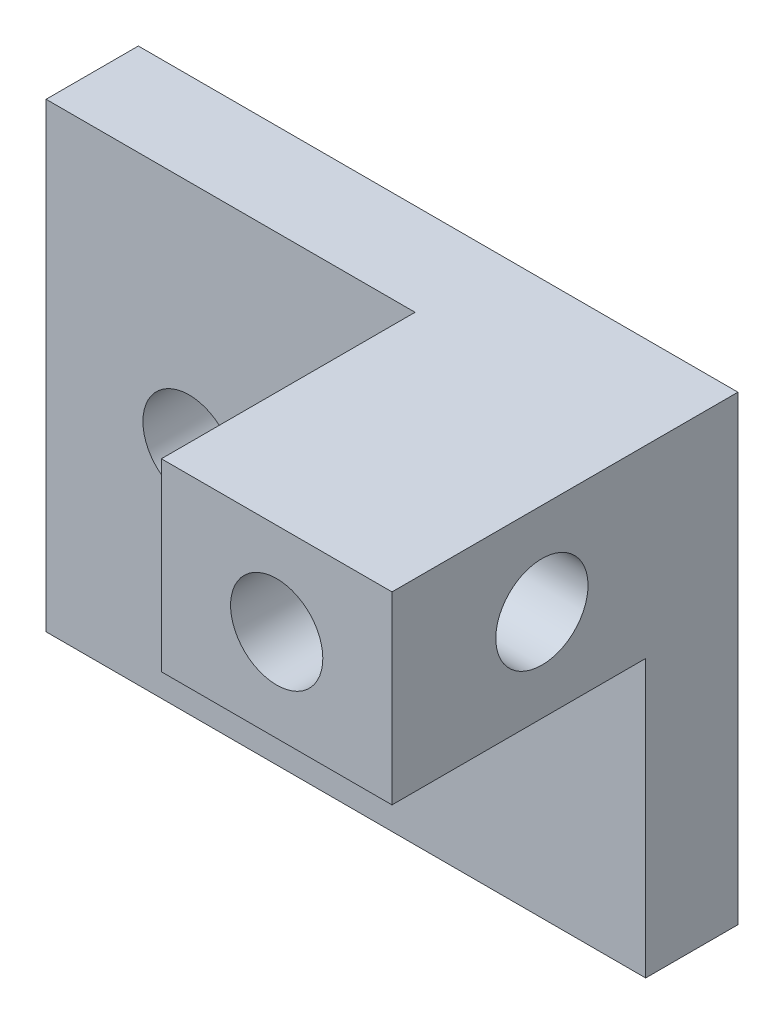
from build123d import *

# Parameters (mm, degrees)
SKETCH_1_W          = 130
SKETCH_1_H          = 100
EXTRUDE_1_DEPTH     = 20
SKETCH_2_W          = 60
SKETCH_2_H          = 76
SKETCH_2_W_2        = 38
CUT_EXTRUDE_1_DEPTH = 10
SKETCH_3_W          = 50
SKETCH_3_H          = 40
EXTRUDE_2_DEPTH     = 65
SKETCH_4_R          = 10
CUT_EXTRUDE_2_DEPTH = 105.642247682
SKETCH_5_R          = 10
CUT_EXTRUDE_3_DEPTH = 121.519707932
SKETCH_6_R          = 10
CUT_EXTRUDE_4_DEPTH = 112.130553854
EXTRUDE_START       = 10
SKETCH_7_W          = 38
SKETCH_7_H          = 76
SKETCH_7_R          = 10
EXTRUDE_3_DEPTH     = 10


with BuildPart() as part:
    # Эскиз1 → Бобышка-Вытянуть1 (new body)
    with BuildSketch(Plane.XY):
        Rectangle(SKETCH_1_W, SKETCH_1_H)
    extrude(amount=EXTRUDE_1_DEPTH)

    # Эскиз2 → Вырез-Вытянуть1 (cut)
    with BuildSketch(Plane.XY.offset(20)):
        with Locations((23, 0)):
            Rectangle(SKETCH_2_W, SKETCH_2_H)
        with Locations((-34, 0)):
            Rectangle(SKETCH_2_W_2, SKETCH_2_H)
    extrude(amount=-CUT_EXTRUDE_1_DEPTH, mode=Mode.SUBTRACT)

    # Эскиз3 → Бобышка-Вытянуть2 (add)
    with BuildSketch(Plane.XY.offset(10)):
        with Locations((40, 30)):
            Rectangle(SKETCH_3_W, SKETCH_3_H)
    extrude(amount=EXTRUDE_2_DEPTH)

    # Эскиз4 → Вырез-Вытянуть2 (cut, through all)
    with BuildSketch(Plane.XY.offset(10)):
        with Locations((-34, 0)):
            Circle(SKETCH_4_R)
    extrude(amount=-CUT_EXTRUDE_2_DEPTH, mode=Mode.SUBTRACT)

    # Эскиз5 → Вырез-Вытянуть3 (cut, through all)
    with BuildSketch(Plane.ZY.offset(-15)):
        with Locations(Location((42.5, 30, 0), (0, 0, 270))):
            Circle(SKETCH_5_R)
    extrude(amount=-CUT_EXTRUDE_3_DEPTH, mode=Mode.SUBTRACT)

    # Эскиз6 → Вырез-Вытянуть4 (cut, through all)
    with BuildSketch(Plane.XY.offset(75)):
        with Locations((40, 30)):
            Circle(SKETCH_6_R)
    extrude(amount=-CUT_EXTRUDE_4_DEPTH, mode=Mode.SUBTRACT)

    # Эскиз7 → Бобышка-Вытянуть3 (add)
    # profile 1 of 2: a face of its own
    with BuildSketch(Plane.XY.offset(10).offset(EXTRUDE_START)):
        Polygon((15, 10), (15, 38), (-7, 38), (-7, -38), (53, -38), (53, 10), align=None)
    # profile 2 of 2: a face of its own
    with BuildSketch(Plane.XY.offset(10).offset(EXTRUDE_START)):
        with Locations((-34, 0)):
            Rectangle(SKETCH_7_W, SKETCH_7_H)
        with Locations((-34, 0)):
            Circle(SKETCH_7_R, mode=Mode.SUBTRACT)
    extrude(amount=-EXTRUDE_3_DEPTH)


solid = part.part
